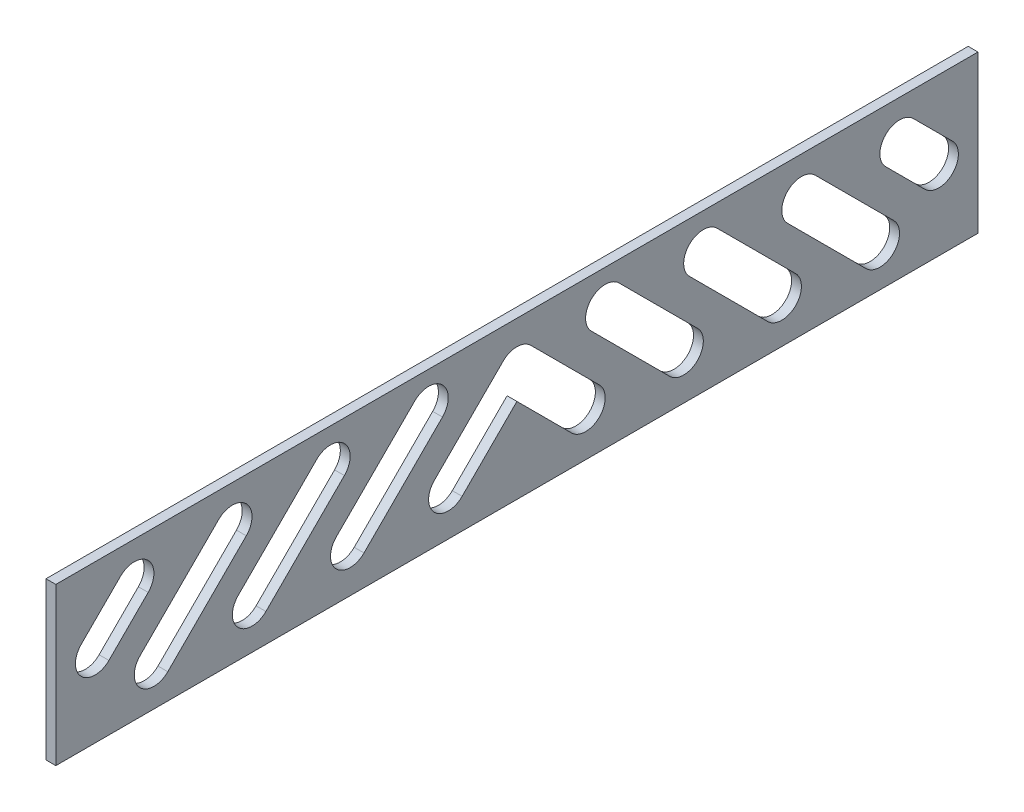
from build123d import *

# Parameters (mm, degrees)
SKETCH1_W           = 596.9
SKETCH1_H           = 101.6
BOSS_EXTRUDE1_DEPTH = 6.35
CUT_EXTRUDE1_DEPTH  = 382.711392197


with BuildPart() as part:
    # Sketch1 → Boss-Extrude1 (new body)
    with BuildSketch(Plane(origin=(0, 0, 0), x_dir=(0, 0, -1), z_dir=(1, 0, 0))):
        with Locations((79.777918782, -0.25786802)):
            Rectangle(SKETCH1_W, SKETCH1_H)
    extrude(amount=BOSS_EXTRUDE1_DEPTH)

    # Sketch2 → Cut-Extrude1 (cut, through all)
    with BuildSketch(Plane(origin=(6.35, 0, 0), x_dir=(0, 0, -1), z_dir=(1, 0, 0))):
        with BuildLine():
            Line((-184.291825097, -9.238124141), (-158.891825097, 16.161875859))
            ThreePointArc((-158.891825097, 16.161875859), (-158.891825097, 34.122388101), (-176.852337339, 34.122388101))
            Line((-176.852337339, 34.122388101), (-202.252337339, 8.722388101))
            ThreePointArc((-202.252337339, 8.722388101), (-202.252337339, -9.238124141), (-184.291825097, -9.238124141))
        make_face()
        with BuildLine():
            Line((-146.191825097, -34.638124141), (-95.391825097, 16.161875859))
            ThreePointArc((-95.391825097, 16.161875859), (-95.391825097, 34.122388101), (-113.352337339, 34.122388101))
            Line((-113.352337339, 34.122388101), (-164.152337339, -16.677611899))
            ThreePointArc((-164.152337339, -16.677611899), (-164.152337339, -34.638124141), (-146.191825097, -34.638124141))
        make_face()
        with BuildLine():
            Line((-49.852337339, 36.142172524), (-100.652337339, -14.657827476))
            ThreePointArc((-100.652337339, -14.657827476), (-100.652337339, -32.618339718), (-82.691825097, -32.618339718))
            Line((-82.691825097, -32.618339718), (-31.891825097, 18.181660282))
            ThreePointArc((-31.891825097, 18.181660282), (-31.891825097, 36.142172524), (-49.852337339, 36.142172524))
        make_face()
        with BuildLine():
            Line((13.647662661, 37.197640065), (-37.152337339, -13.602359935))
            ThreePointArc((-37.152337339, -13.602359935), (-37.152337339, -31.562872177), (-19.191825097, -31.562872177))
            Line((-19.191825097, -31.562872177), (31.608174903, 19.237127823))
            ThreePointArc((31.608174903, 19.237127823), (31.608174903, 37.197640065), (13.647662661, 37.197640065))
        make_face()
        with BuildLine():
            Line((70.797662661, 30.847640065), (26.347662661, -13.602359935))
            ThreePointArc((26.347662661, -13.602359935), (26.347662661, -31.562872177), (44.308174903, -31.562872177))
            Line((44.308174903, -31.562872177), (79.777918782, 3.906871702))
            Line((79.777918782, 3.906871702), (115.247662661, -31.562872177))
            ThreePointArc((115.247662661, -31.562872177), (133.208174903, -31.562872177), (133.208174903, -13.602359935))
            Line((133.208174903, -13.602359935), (88.758174903, 30.847640065))
            ThreePointArc((88.758174903, 30.847640065), (79.777918782, 34.567383944), (70.797662661, 30.847640065))
        make_face()
        with BuildLine():
            ThreePointArc((178.747662661, -31.562872177), (196.708174903, -31.562872177), (196.708174903, -13.602359935))
            Line((196.708174903, -13.602359935), (145.908174903, 37.197640065))
            ThreePointArc((145.908174903, 37.197640065), (127.947662661, 37.197640065), (127.947662661, 19.237127823))
            Line((127.947662661, 19.237127823), (178.747662661, -31.562872177))
        make_face()
        with BuildLine():
            ThreePointArc((242.247662661, -32.618339718), (260.208174903, -32.618339718), (260.208174903, -14.657827476))
            Line((260.208174903, -14.657827476), (209.408174903, 36.142172524))
            ThreePointArc((209.408174903, 36.142172524), (191.447662661, 36.142172524), (191.447662661, 18.181660282))
            Line((191.447662661, 18.181660282), (242.247662661, -32.618339718))
        make_face()
        with BuildLine():
            ThreePointArc((272.908174903, 34.122388101), (254.947662661, 34.122388101), (254.947662661, 16.161875859))
            Line((254.947662661, 16.161875859), (305.747662661, -34.638124141))
            ThreePointArc((305.747662661, -34.638124141), (323.708174903, -34.638124141), (323.708174903, -16.677611899))
            Line((323.708174903, -16.677611899), (272.908174903, 34.122388101))
        make_face()
        with BuildLine():
            ThreePointArc((336.408174903, 34.122388101), (318.447662661, 34.122388101), (318.447662661, 16.161875859))
            Line((318.447662661, 16.161875859), (343.847662661, -9.238124141))
            ThreePointArc((343.847662661, -9.238124141), (361.808174903, -9.238124141), (361.808174903, 8.722388101))
            Line((361.808174903, 8.722388101), (336.408174903, 34.122388101))
        make_face()
    extrude(amount=-CUT_EXTRUDE1_DEPTH, mode=Mode.SUBTRACT)


solid = part.part
